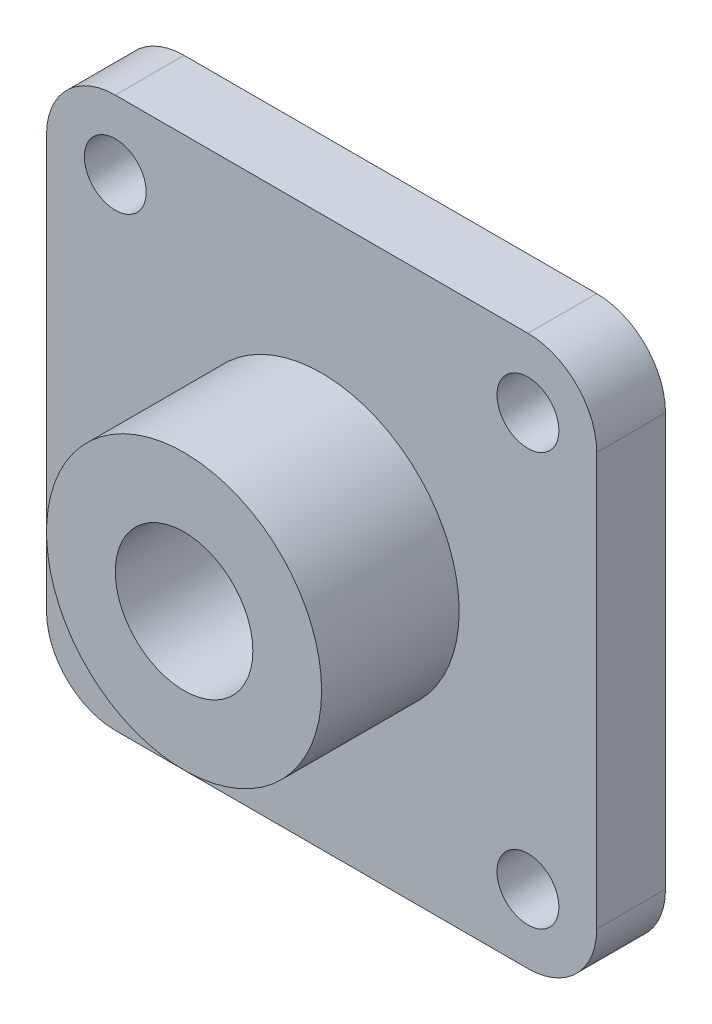
from build123d import *

# Parameters (mm, degrees)
EXTRUDE_1_DEPTH     = 10
SKETCH_2_R          = 20
EXTRUDE_2_DEPTH     = 20
SKETCH_3_R          = 4.5
CUT_EXTRUDE_1_DEPTH = 81
SKETCH_4_R          = 10
CUT_EXTRUDE_2_DEPTH = 65.031242374


with BuildPart() as part:
    # 草图1 → 凸台-拉伸1 (new body)
    with BuildSketch(Plane.XY):
        with BuildLine():
            Line((-30, -40), (30, -40))
            ThreePointArc((30, -40), (37.071067812, -37.071067812), (40, -30))
            Line((40, -30), (40, 30))
            ThreePointArc((40, 30), (37.071067812, 37.071067812), (30, 40))
            Line((30, 40), (-30, 40))
            ThreePointArc((-30, 40), (-37.071067812, 37.071067812), (-40, 30))
            Line((-40, 30), (-40, -30))
            ThreePointArc((-40, -30), (-37.071067812, -37.071067812), (-30, -40))
        make_face()
    extrude(amount=EXTRUDE_1_DEPTH)

    # 草图2 → 凸台-拉伸2 (add)
    with BuildSketch(Plane.XY.offset(10)):
        Circle(SKETCH_2_R)
    extrude(amount=EXTRUDE_2_DEPTH)

    # 草图3 → 切除-拉伸1 (cut, symmetric)
    with BuildSketch(Plane.XY):
        with Locations((30, 30)):
            Circle(SKETCH_3_R)
        with Locations((-30, 30)):
            Circle(SKETCH_3_R)
        with Locations((-30, -30)):
            Circle(SKETCH_3_R)
        with Locations((30, -30)):
            Circle(SKETCH_3_R)
    extrude(amount=CUT_EXTRUDE_1_DEPTH, both=True, mode=Mode.SUBTRACT)

    # 草图4 → 切除-拉伸2 (cut, through all)
    with BuildSketch(Plane.XY.offset(30)):
        Circle(SKETCH_4_R)
    extrude(amount=-CUT_EXTRUDE_2_DEPTH, mode=Mode.SUBTRACT)


solid = part.part
